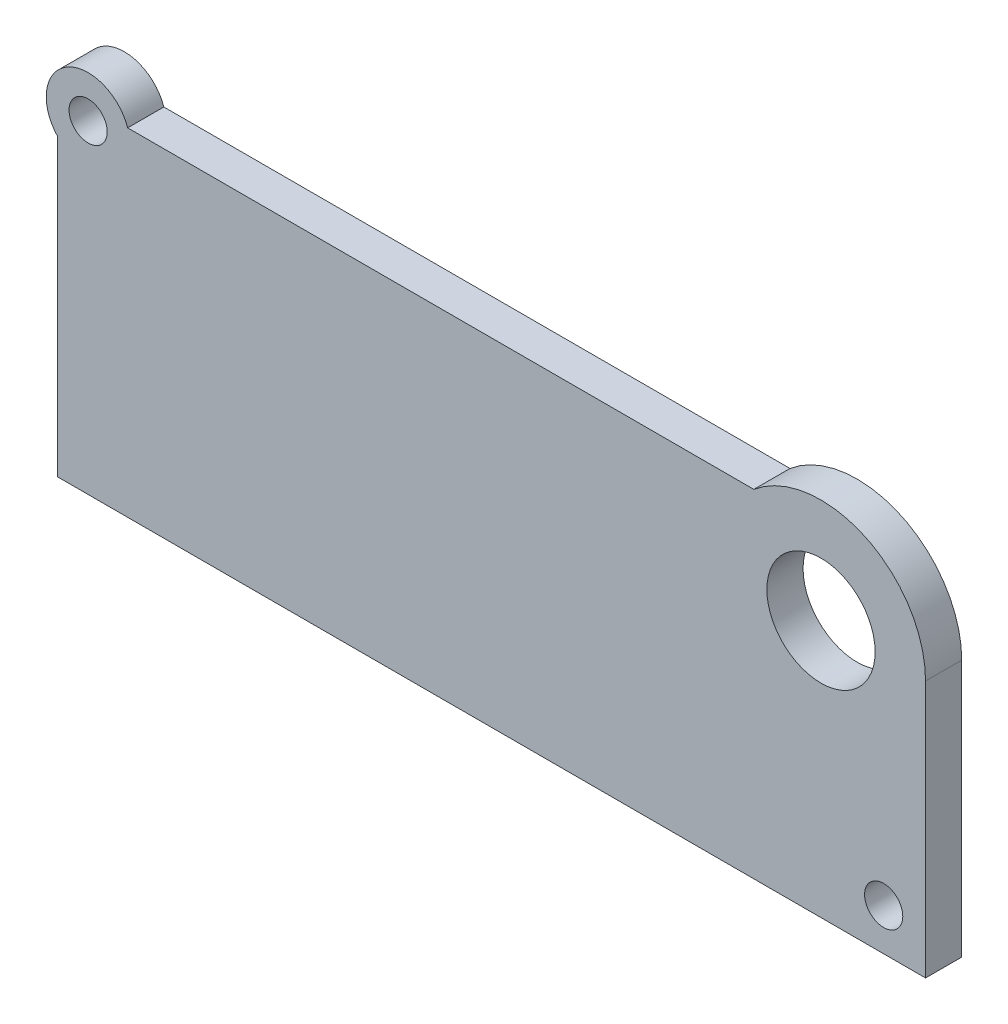
from build123d import *

# Parameters (mm, degrees)
SKETCH1_W            = 6.266
SKETCH1_H            = 19.6
SKETCH1_R            = 1.675
SKETCH1_W_2          = 52.832
SKETCH1_H_2          = 5
BOSS_EXTRUDE2_DEPTH  = 3.175
SKETCH3_W            = 30
SKETCH3_H            = 29.6
BOSS_EXTRUDE3_DEPTH  = 3.175
SKETCH4_R            = 4.75
CUT_EXTRUDE1_DEPTH   = 10
BOSS_EXTRUDE14_DEPTH = 3.175
CUT_EXTRUDE8_DEPTH   = 10
SKETCH24_R           = 1.675
CUT_EXTRUDE9_DEPTH   = 10
SKETCH25_R           = 3.675
SKETCH25_R_2         = 1.675
BOSS_EXTRUDE15_DEPTH = 3.175
SKETCH26_R           = 1.675
CUT_EXTRUDE12_DEPTH  = 3.175
SKETCH27_W           = 52.932563224
SKETCH27_H           = 23.005559857
BOSS_EXTRUDE16_DEPTH = 3.175
CUT_EXTRUDE14_DEPTH  = 10


with BuildPart() as part:
    # Sketch1 → Boss-Extrude2 (new body)
    # profile 1 of 4: a face of its own
    with BuildSketch(Plane.XY):
        with Locations((-23.283, 0)):
            Rectangle(SKETCH1_W, SKETCH1_H)
        with Locations((-23.95, -4.974)):
            Circle(SKETCH1_R, mode=Mode.SUBTRACT)
        with Locations((-23.95, 4.974)):
            Circle(SKETCH1_R, mode=Mode.SUBTRACT)
    # profile 2 of 4: a face of its own
    with BuildSketch(Plane.XY):
        with Locations((0, -12.3)):
            Rectangle(SKETCH1_W_2, SKETCH1_H_2)
    # profile 3 of 4: a face of its own
    with BuildSketch(Plane.XY):
        with Locations((0, 12.3)):
            Rectangle(SKETCH1_W_2, SKETCH1_H_2)
    # profile 4 of 4: a face of its own
    with BuildSketch(Plane.XY):
        with Locations((23.283, 0)):
            Rectangle(SKETCH1_W, SKETCH1_H)
        with Locations((23.95, -4.974)):
            Circle(SKETCH1_R, mode=Mode.SUBTRACT)
        with Locations((23.95, 4.974)):
            Circle(SKETCH1_R, mode=Mode.SUBTRACT)
    extrude(amount=BOSS_EXTRUDE2_DEPTH)

    # Sketch3 → Boss-Extrude3 (add)
    with BuildSketch(Plane.XY.offset(3.175)):
        with Locations((41.416, 0)):
            Rectangle(SKETCH3_W, SKETCH3_H)
    extrude(amount=-BOSS_EXTRUDE3_DEPTH)

    # Sketch4 → Cut-Extrude1 (cut)
    with BuildSketch(Plane(origin=(0, 0, 0), x_dir=(-1, 0, 0), z_dir=(0, 0, -1))):
        with Locations((-40.576, 7.77)):
            Circle(SKETCH4_R)
    extrude(amount=-CUT_EXTRUDE1_DEPTH, mode=Mode.SUBTRACT)

    # Sketch22 → Boss-Extrude14 (add)
    with BuildSketch(Plane(origin=(0, 0, 0), x_dir=(-1, 0, 0), z_dir=(0, 0, -1))):
        with BuildLine():
            ThreePointArc((-34.680262133, 14.8), (-40.576, 16.945), (-46.471737867, 14.8))
            Line((-46.471737867, 14.8), (-34.680262133, 14.8))
        make_face()
    extrude(amount=-BOSS_EXTRUDE14_DEPTH)

    # Sketch23 → Cut-Extrude8 (cut)
    with BuildSketch(Plane(origin=(0, 0, 0), x_dir=(-1, 0, 0), z_dir=(0, 0, -1))):
        with BuildLine():
            Line((-49.751, -14.8), (-49.751, 7.77))
            ThreePointArc((-49.751, 7.77), (-48.890866804, 11.648609936), (-46.471737867, 14.8))
            Line((-46.471737867, 14.8), (-56.416, 14.8))
            Line((-56.416, 14.8), (-56.416, -14.8))
            Line((-56.416, -14.8), (-49.751, -14.8))
        make_face()
    extrude(amount=-CUT_EXTRUDE8_DEPTH, mode=Mode.SUBTRACT)

    # Sketch24 → Cut-Extrude9 (cut)
    with BuildSketch(Plane(origin=(0, 0, 0), x_dir=(-1, 0, 0), z_dir=(0, 0, -1))):
        with Locations((23.736, 13.59)):
            Circle(SKETCH24_R)
    extrude(amount=-CUT_EXTRUDE9_DEPTH, mode=Mode.SUBTRACT)

    # Sketch25 → Boss-Extrude15 (add)
    # profile 1 of 3: a face of its own
    with BuildSketch(Plane(origin=(0, 0, 0), x_dir=(-1, 0, 0), z_dir=(0, 0, -1))):
        with Locations((23.95, -4.974)):
            Circle(SKETCH25_R)
        with Locations(Location((23.95, -4.974, 0), (0, 0, 180))):
            Circle(SKETCH25_R_2, mode=Mode.SUBTRACT)
    # profile 2 of 3: a face of its own
    with BuildSketch(Plane(origin=(0, 0, 0), x_dir=(-1, 0, 0), z_dir=(0, 0, -1))):
        with Locations((23.95, 4.974)):
            Circle(SKETCH25_R)
        with Locations(Location((23.95, 4.974, 0), (0, 0, 180))):
            Circle(SKETCH25_R_2, mode=Mode.SUBTRACT)
    # profile 3 of 3: a face of its own
    with BuildSketch(Plane(origin=(0, 0, 0), x_dir=(-1, 0, 0), z_dir=(0, 0, -1))):
        with Locations((23.736, 13.59)):
            Circle(SKETCH25_R)
        with Locations((23.736, 13.59)):
            Circle(SKETCH25_R_2, mode=Mode.SUBTRACT)
    extrude(amount=-BOSS_EXTRUDE15_DEPTH)

    # Sketch26 → Cut-Extrude12 (cut)
    with BuildSketch(Plane(origin=(0, 0, 0), x_dir=(-1, 0, 0), z_dir=(0, 0, -1))):
        with Locations((-46.076, -11.125)):
            Circle(SKETCH26_R)
    extrude(amount=-CUT_EXTRUDE12_DEPTH, mode=Mode.SUBTRACT)

    # Sketch27 → Boss-Extrude16 (add)
    with BuildSketch(Plane(origin=(0, 0, 0), x_dir=(-1, 0, 0), z_dir=(0, 0, -1))):
        with Locations((-0.417160697, -0.481381251)):
            Rectangle(SKETCH27_W, SKETCH27_H)
    extrude(amount=-BOSS_EXTRUDE16_DEPTH)

    # Sketch28 → Cut-Extrude14 (cut)
    with BuildSketch(Plane(origin=(0, 0, 0), x_dir=(-1, 0, 0), z_dir=(0, 0, -1))):
        Polygon((26.416, 8.97792488), (26.416, -8.885991227), (33.695668031, -3.414754928), align=None)
    extrude(amount=-CUT_EXTRUDE14_DEPTH, mode=Mode.SUBTRACT)


solid = part.part
